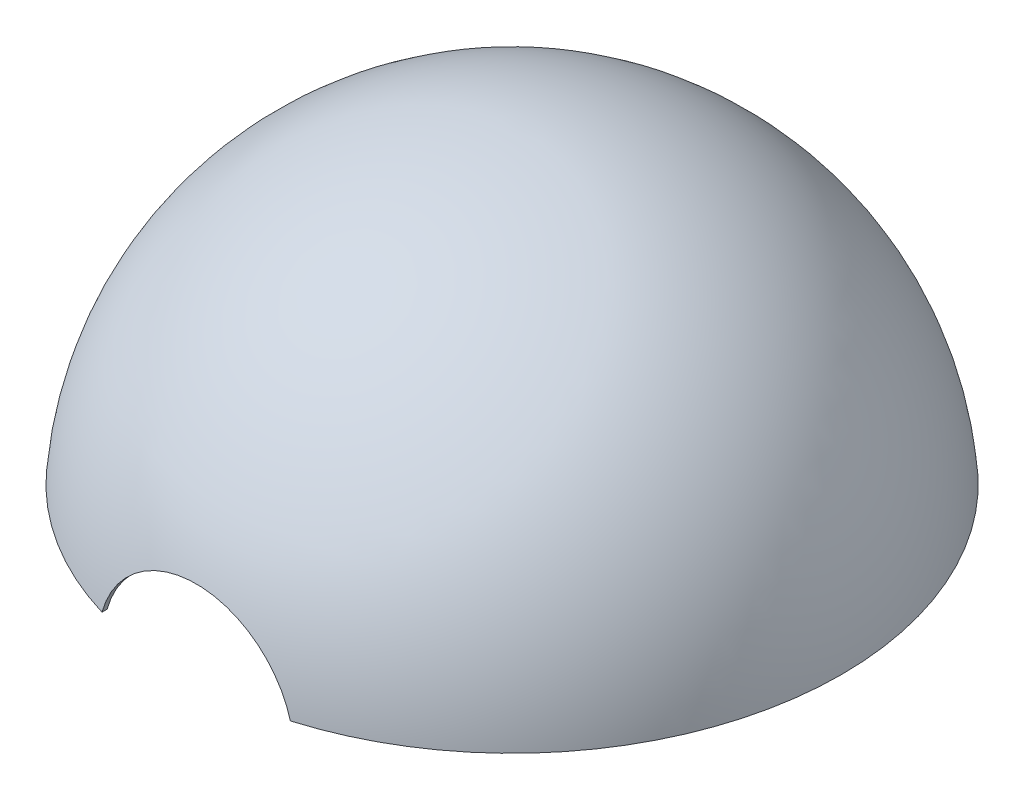
from build123d import *

# Parameters (mm, degrees)
SKETCH2_R          = 7.5
CUT_EXTRUDE1_DEPTH = 44.859683936


with BuildPart() as part:
    # Sketch1 → Revolve1 (revolve)
    with BuildSketch(Plane.XY):
        with BuildLine():
            Line((0, 25), (0, 25.375))
            ThreePointArc((0, 25.375), (17.221216929, 18.636531665), (25.296059476, 2))
            Line((25.296059476, 2), (24.919871589, 2))
            ThreePointArc((24.919871589, 2), (16.955824958, 18.371173071), (0, 25))
        make_face()
    revolve(axis=Axis((0, 25, 0), (0, 1, 0)))

    # Sketch2 → Cut-Extrude1 (cut, through all)
    with BuildSketch(Plane.XY):
        Circle(SKETCH2_R)
    extrude(amount=CUT_EXTRUDE1_DEPTH, mode=Mode.SUBTRACT)


solid = part.part
